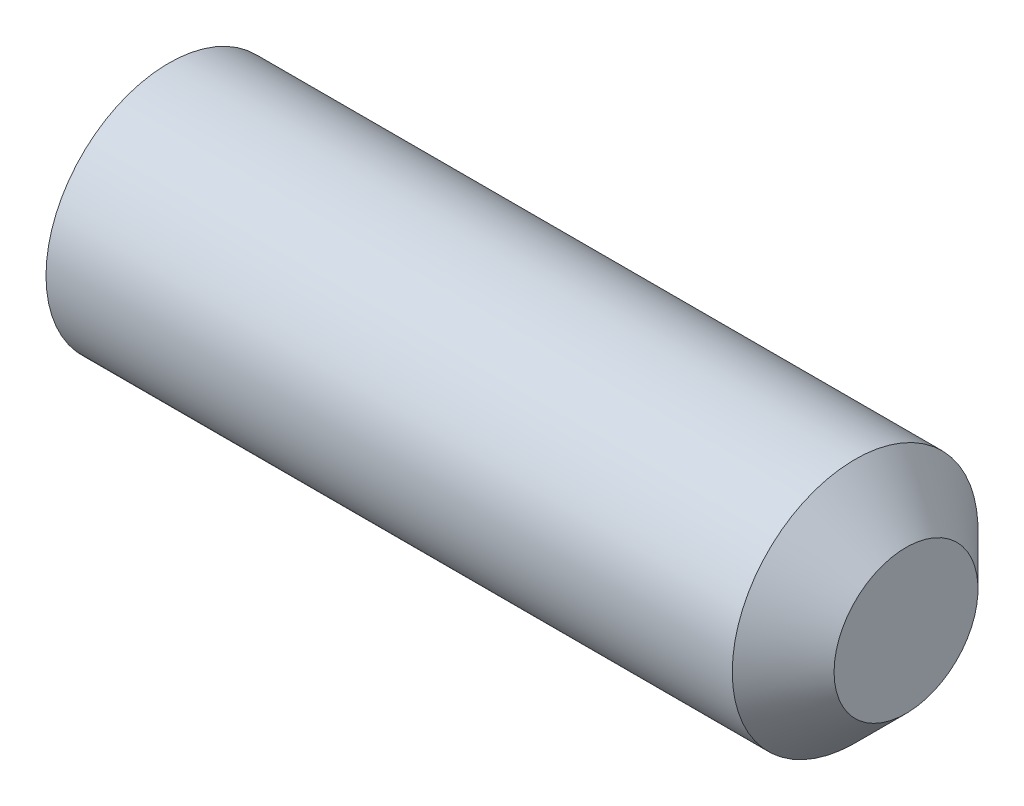
from build123d import *

# Parameters (mm, degrees)
CUT_EXTRUDE1_DEPTH = 3


with BuildPart() as part:
    # Sketch1 → Revolve1 (revolve)
    with BuildSketch(Plane.XY, mode=Mode.PRIVATE) as revolve1_sk:
        Polygon((30, 2.928932188), (30, 0), (0, 0), (0, 5), (27.928932188, 5), align=None)
    revolve(revolve1_sk.sketch.rotate(Axis((0, 0, 0), (1, 0, 0)), 90), axis=Axis((0, 0, 0), (1, 0, 0)))

    # Sketch2 → Cut-Extrude1 (cut)
    with BuildSketch(Plane.ZY):
        Polygon((-1.443375673, 2.5), (-2.886751346, 0), (-1.443375673, -2.5), (1.443375673, -2.5), (2.886751346, 0), (1.443375673, 2.5), align=None)
    extrude(amount=-CUT_EXTRUDE1_DEPTH, mode=Mode.SUBTRACT)


solid = part.part
